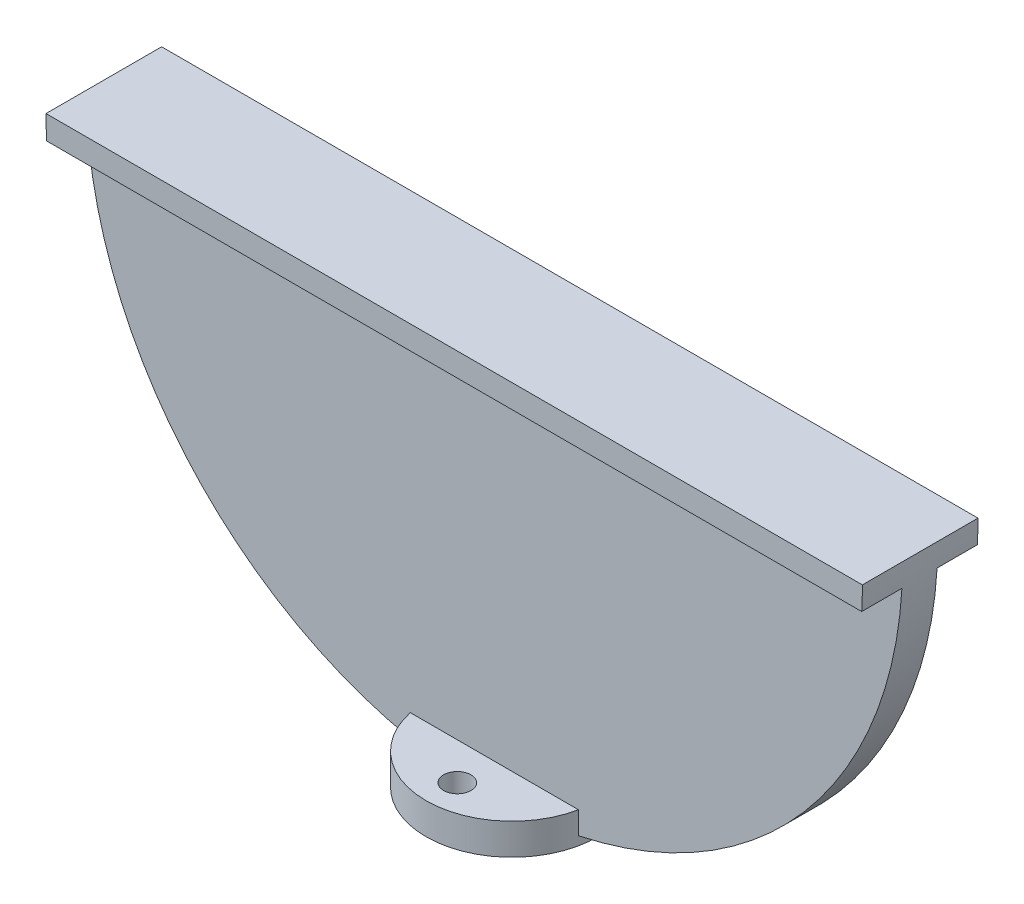
from build123d import *

# Parameters (mm, degrees)
EXTRUDE_1_DEPTH     = 4.5
EXTRUDE_2_DEPTH     = 7.4
SKETCH_3_R          = 11
EXTRUDE_3_DEPTH     = 4
CUT_EXTRUDE_2_REACH = 77.071
SKETCH_7_R          = 1.75


with BuildPart() as part:
    # 草图1 → 凸台-拉伸1 (new body)
    with BuildSketch(Plane.XY):
        with BuildLine():
            Line((-52.25, 0), (52.25, 0))
            ThreePointArc((52.25, 0), (0, -52.25), (-52.25, 0))
        make_face()
    extrude(amount=EXTRUDE_1_DEPTH)

    # 草图2 → 凸台-拉伸2 (add, symmetric)
    with BuildSketch(Plane.XY.offset(2.25)):
        with BuildLine():
            Line((-52.25, 0), (52.25, 0))
            ThreePointArc((52.25, 0), (52.22844668, -1.500619011), (52.163804501, -3))
            Line((52.163804501, -3), (-52.163804501, -3))
            ThreePointArc((-52.163804501, -3), (-52.22844668, -1.500619011), (-52.25, 0))
        make_face()
    extrude(amount=EXTRUDE_2_DEPTH, both=True)

    # 草图3 → 凸台-拉伸3 (add)
    with BuildSketch(Plane(origin=(0, -52.25, 0), x_dir=(1, 0, 0), z_dir=(0, 1, 0))):
        with Locations(Location((0, -2.25, 0), (0, 0, 168.19710831))):
            Circle(SKETCH_3_R)
    extrude(amount=EXTRUDE_3_DEPTH)

    # 草图7 → 切除-拉伸2 (cut, up to next)
    with BuildSketch(Plane.XZ.offset(52.25), mode=Mode.PRIVATE) as cut_extrude_2_sk1:
        with Locations(Location((0, 9.25, 0), (0, 0, 270))):
            Circle(SKETCH_7_R)
    cut_extrude_2_tool1 = extrude(cut_extrude_2_sk1.sketch, amount=-CUT_EXTRUDE_2_REACH, mode=Mode.PRIVATE) & part.part
    # 草图7 → 切除-拉伸2 (cut, up to next)
    with BuildSketch(Plane.XZ.offset(52.25), mode=Mode.PRIVATE) as cut_extrude_2_sk2:
        with Locations(Location((0, -4.75, 0), (0, 0, 270))):
            Circle(SKETCH_7_R)
    cut_extrude_2_tool2 = extrude(cut_extrude_2_sk2.sketch, amount=-CUT_EXTRUDE_2_REACH, mode=Mode.PRIVATE) & part.part
    add(cut_extrude_2_tool1.solids().sort_by_distance((0, -52.25, 9.25))[0], mode=Mode.SUBTRACT)
    add(cut_extrude_2_tool2.solids().sort_by_distance((0, -52.25, -4.75))[0], mode=Mode.SUBTRACT)


solid = part.part
